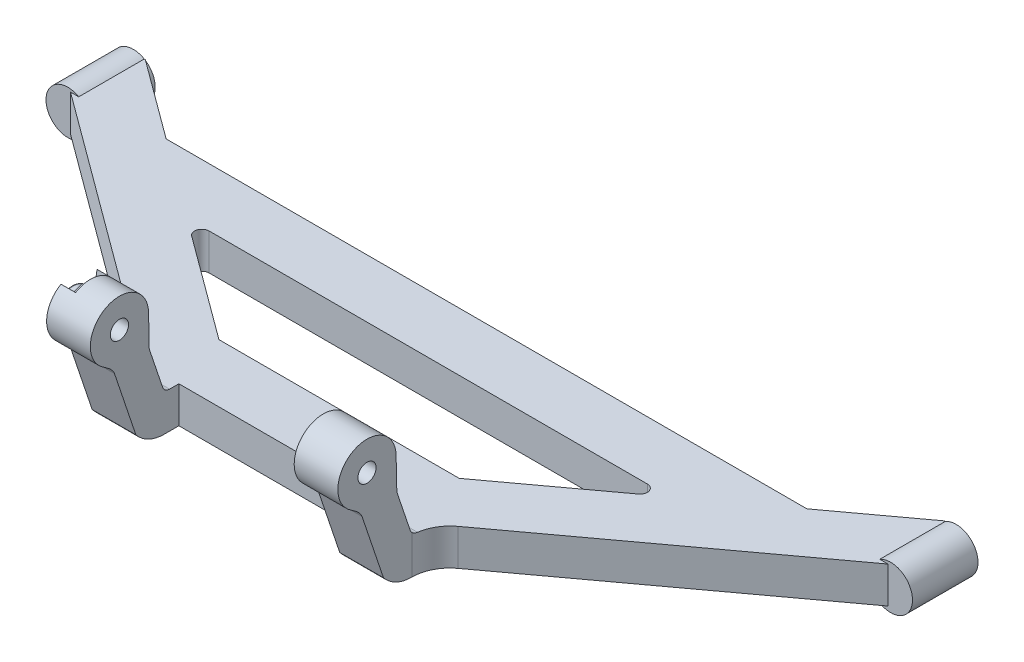
from build123d import *

# Parameters (mm, degrees)
BOSS_EXTRUDE1_DEPTH  = 5
SKETCH2_R            = 3
BOSS_EXTRUDE2_DEPTH  = 9
CUT_EXTRUDE2_DEPTH   = 9
SKETCH5_R            = 1
CUT_EXTRUDE3_DEPTH   = 7
SKETCH6_R            = 4
SKETCH6_R_2          = 1.25
BOSS_EXTRUDE3_DEPTH  = 6
FILLET1_R            = 1
FILLET1_OF_MIRROR3_R = 1
SKETCH7_R            = 1.25
CUT_EXTRUDE4_DEPTH   = 2
SKETCH8_R            = 1.25
BOSS_EXTRUDE4_DEPTH  = 1.5
SKETCH9_R            = 2.104951794
SKETCH9_R_2          = 1.25
BOSS_EXTRUDE5_DEPTH  = 1
FILLET2_R            = 0.25


with BuildPart() as part:
    # Sketch1 → Boss-Extrude1 (new body)
    with BuildSketch(Plane(origin=(0, 0, 0), x_dir=(1, 0, 0), z_dir=(0, 1, 0))):
        with BuildLine():
            Line((44, 20.25), (-44, 20.25))
            Line((-44, 20.25), (-54.864197531, 28.25))
            Line((-54.864197531, 28.25), (-59.5, 28.25))
            Line((-59.5, 28.25), (-59.5, 19.25))
            Line((-59.5, 19.25), (-56.133853902, 19.25))
            Line((-56.133853902, 19.25), (-22.127720492, -5.790880057))
            ThreePointArc((-22.127720492, -5.790880057), (-20.56215902, -7.641828824), (-20, -10))
            Line((-20, -10), (-14, -10))
            Line((-14, -10), (-14, -8))
            Line((-14, -8), (14, -8))
            Line((14, -8), (14, -10))
            Line((14, -10), (20, -10))
            ThreePointArc((20, -10), (20.56215902, -7.641828824), (22.127720492, -5.790880057))
            Line((22.127720492, -5.790880057), (56.133853902, 19.25))
            Line((56.133853902, 19.25), (59.5, 19.25))
            Line((59.5, 19.25), (59.5, 28.25))
            Line((59.5, 28.25), (54.864197531, 28.25))
            Line((54.864197531, 28.25), (44, 20.25))
        make_face()
        with BuildLine():
            Line((16.5, 0), (-16.5, 0))
            Line((-16.5, 0), (-30.684242256, 10.444760207))
            ThreePointArc((-30.684242256, 10.444760207), (-31.041356055, 11.562057853), (-30.091292954, 12.25))
            Line((-30.091292954, 12.25), (30.091292954, 12.25))
            ThreePointArc((30.091292954, 12.25), (31.041356055, 11.562057853), (30.684242256, 10.444760207))
            Line((30.684242256, 10.444760207), (16.5, 0))
        make_face(mode=Mode.SUBTRACT)
    extrude(amount=BOSS_EXTRUDE1_DEPTH)

    # Sketch2 → Boss-Extrude2 (add)
    with BuildSketch(Plane(origin=(0, 0, -28.25), x_dir=(-1, 0, 0), z_dir=(0, 0, -1))):
        with Locations((56.5, 2.399773273)):
            Circle(SKETCH2_R)
    boss_extrude2 = extrude(amount=-BOSS_EXTRUDE2_DEPTH)

    # Sketch3 → Cut-Extrude2 (cut)
    with BuildSketch(Plane(origin=(0, 0, -28.25), x_dir=(-1, 0, 0), z_dir=(0, 0, -1))):
        with BuildLine():
            Line((60.611507076, 5.399773273), (56.5, 5.399773273))
            ThreePointArc((56.5, 5.399773273), (57.274377111, 5.298107293), (57.996269016, 5))
            Line((57.996269016, 5), (59.5, 5))
            Line((59.5, 5), (59.5, 2.399773273))
            Line((59.5, 2.399773273), (59.5, 0))
            Line((59.5, 0), (58.300302263, 0))
            ThreePointArc((58.300302263, 0), (57.448862524, -0.446216873), (56.5, -0.600226727))
            Line((56.5, -0.600226727), (60.611507076, -0.600226727))
            Line((60.611507076, -0.600226727), (60.611507076, 5.399773273))
        make_face()
        with BuildLine():
            Line((59.5, 5), (57.996269016, 5))
            ThreePointArc((57.996269016, 5), (59.096998946, 3.901637606), (59.5, 2.399773273))
            Line((59.5, 2.399773273), (59.5, 5))
        make_face()
        with BuildLine():
            Line((59.5, 0), (59.5, 2.399773273))
            ThreePointArc((59.5, 2.399773273), (59.183366057, 1.058301467), (58.300302263, 0))
            Line((58.300302263, 0), (59.5, 0))
        make_face()
    cut_extrude2 = extrude(amount=-CUT_EXTRUDE2_DEPTH, mode=Mode.SUBTRACT)

    # Sketch5 → Cut-Extrude3 (cut)
    with BuildSketch(Plane(origin=(0, 0, -28.25), x_dir=(-1, 0, 0), z_dir=(0, 0, -1))):
        with Locations((56.5, 2.399773273)):
            Circle(SKETCH5_R)
    cut_extrude3 = extrude(amount=-CUT_EXTRUDE3_DEPTH, mode=Mode.SUBTRACT)

    # Mirror1: Boss-Extrude2, Cut-Extrude2, Cut-Extrude3 across plane
    add(boss_extrude2.mirror(Plane(origin=(0, 0, 0), x_dir=(0, 0, 1), z_dir=(1, 0, 0))))
    add(cut_extrude2.mirror(Plane(origin=(0, 0, 0), x_dir=(0, 0, 1), z_dir=(1, 0, 0))), mode=Mode.SUBTRACT)
    add(cut_extrude3.mirror(Plane(origin=(0, 0, 0), x_dir=(0, 0, 1), z_dir=(1, 0, 0))), mode=Mode.SUBTRACT)

    # Sketch6 → Boss-Extrude3 (add)
    # profile 1 of 4: a face of its own
    with BuildSketch(Plane(origin=(-14, 0, 0), x_dir=(0, 0, -1), z_dir=(1, 0, 0))):
        with BuildLine():
            Line((-10, 0), (-10, 5))
            Line((-10, 5), (-12.067952412, 11.15441805))
            Line((-12.067952412, 11.15441805), (-12.801123052, 13.336401829))
            ThreePointArc((-12.801123052, 13.336401829), (-14.714307507, 11.772518008), (-17.18129323, 11.631136219))
            Line((-17.18129323, 11.631136219), (-16.850726128, 10.647337883))
            Line((-16.850726128, 10.647337883), (-13.903123749, 1.875))
            ThreePointArc((-13.903123749, 1.875), (-12.165063509, 0.493060906), (-10, 0))
        make_face()
    # profile 2 of 4: a face of its own
    with BuildSketch(Plane(origin=(-14, 0, 0), x_dir=(0, 0, -1), z_dir=(1, 0, 0))):
        with BuildLine():
            Line((-16.850726128, 10.647337883), (-17.18129323, 11.631136219))
            ThreePointArc((-17.18129323, 11.631136219), (-17.781137494, 11.840816405), (-18.340208526, 12.142840417))
            add(Edge.make_bspline(
                [(-18.340208526, 12.142840417), (-17.078630295, 11.325601808), (-16.850726128, 10.647337883)],
                knots=[0, 0, 0, 1, 1, 1], degree=2))
        make_face()
    # profile 3 of 4: a face of its own
    with BuildSketch(Plane(origin=(-14, 0, 0), x_dir=(0, 0, -1), z_dir=(1, 0, 0))):
        with Locations((-16.165471867, 15.5)):
            Circle(SKETCH6_R)
        with Locations((-16.165471867, 15.5)):
            Circle(SKETCH6_R_2, mode=Mode.SUBTRACT)
    # profile 4 of 4: a face of its own
    with BuildSketch(Plane(origin=(-14, 0, 0), x_dir=(0, 0, -1), z_dir=(1, 0, 0))):
        with BuildLine():
            Line((-12.801123052, 13.336401829), (-12.067952412, 11.15441805))
            Line((-12.067952412, 11.15441805), (-12.166458423, 15.588833991))
            ThreePointArc((-12.166458423, 15.588833991), (-12.165718514, 15.544419734), (-12.165471867, 15.5))
            ThreePointArc((-12.165471867, 15.5), (-12.327673327, 14.372479548), (-12.801123052, 13.336401829))
        make_face()
    boss_extrude3 = extrude(amount=-BOSS_EXTRUDE3_DEPTH)

    # Fillet1
    fillet1_edges = [part.edges().sort_by_distance(p)[0] for p in [
        (-17, 5, 10),
    ]]
    fillet(fillet1_edges, radius=FILLET1_R)

    # Mirror3: Boss-Extrude3 across plane
    add(boss_extrude3.mirror(Plane(origin=(0, 0, 0), x_dir=(0, 0, 1), z_dir=(1, 0, 0))))

    # Fillet1 of Mirror3
    fillet1_of_mirror3_edges = [part.edges().sort_by_distance(p)[0] for p in [
        (17, 5, 10),
    ]]
    fillet(fillet1_of_mirror3_edges, radius=FILLET1_OF_MIRROR3_R)

    # Sketch7 → Cut-Extrude4 (cut)
    # profile 1 of 2: a face of its own
    with BuildSketch(Plane.ZY.offset(20)):
        with BuildLine():
            Line((13.247212207, 18.235646277), (13.48576811, 16.573555357))
            Line((13.48576811, 16.573555357), (15.7553462, 18.357469207))
            Line((15.7553462, 18.357469207), (18.435049958, 17.28391385))
            Line((18.435049958, 17.28391385), (18.196494055, 18.94600477))
            ThreePointArc((18.196494055, 18.94600477), (15.597185073, 19.459425478), (13.247212207, 18.235646277))
        make_face()
    # profile 2 of 2: a face of its own
    with BuildSketch(Plane.ZY.offset(20)):
        Polygon((13.895893777, 13.71608615), (16.575597534, 12.642530793), (18.845175625, 14.426444643), (18.435049958, 17.28391385), (15.7553462, 18.357469207), (13.48576811, 16.573555357), align=None)
        with Locations(Location((16.165471867, 15.5, 0), (0, 0, 180))):
            Circle(SKETCH7_R, mode=Mode.SUBTRACT)
    extrude(amount=-CUT_EXTRUDE4_DEPTH, mode=Mode.SUBTRACT)

    # Sketch8 → Boss-Extrude4 (add)
    with BuildSketch(Plane.ZY.offset(18)):
        Polygon((15.796358767, 18.071722287), (13.753738485, 16.466199822), (14.122851586, 13.894477535), (16.534584967, 12.928277713), (18.577205249, 14.533800178), (18.208092149, 17.105522465), align=None)
        with Locations(Location((16.165471867, 15.5, 0), (0, 0, 180))):
            Circle(SKETCH8_R, mode=Mode.SUBTRACT)
    extrude(amount=BOSS_EXTRUDE4_DEPTH)

    # Sketch9 → Boss-Extrude5 (add)
    with BuildSketch(Plane.ZY.offset(19.5)):
        with Locations((16.165471867, 15.5)):
            Circle(SKETCH9_R)
        with Locations(Location((16.165471867, 15.5, 0), (0, 0, 180))):
            Circle(SKETCH9_R_2, mode=Mode.SUBTRACT)
    extrude(amount=BOSS_EXTRUDE5_DEPTH)

    # Fillet2
    fillet2_edges = [part.edges().sort_by_distance(p)[0] for p in [
        (-20.5, 15.5, 14.060520073),
    ]]
    fillet(fillet2_edges, radius=FILLET2_R)


solid = part.part
